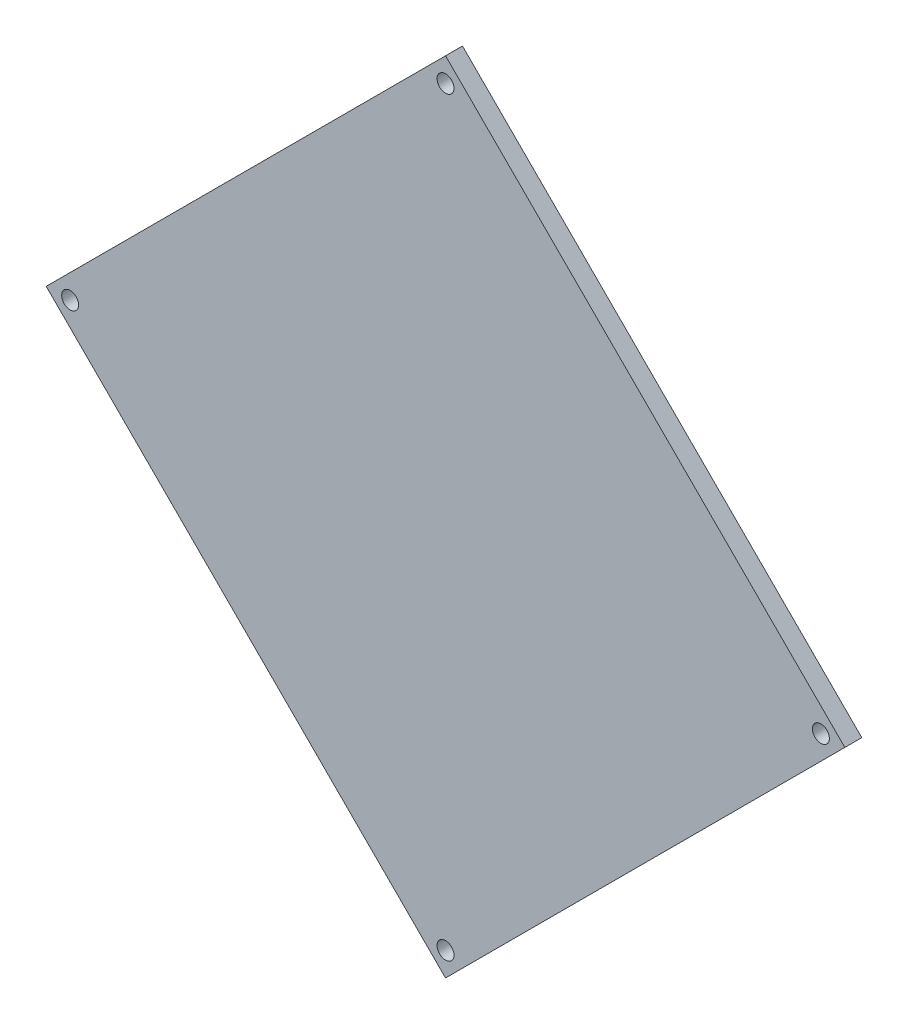
from build123d import *

# Parameters (mm, degrees)
SKETCH_1_R      = 1.5
EXTRUDE_1_DEPTH = 3


with BuildPart() as part:
    # 草图1 → 凸台-拉伸1 (new body)
    with BuildSketch(Plane.XY):
        Polygon((70.710678119, 0), (0, 70.710678119), (-70.710678119, 0), (0, -70.710678119), align=None)
        with Locations((0, 66.468037432)):
            Circle(SKETCH_1_R, mode=Mode.SUBTRACT)
        with Locations((66.468037432, 0)):
            Circle(SKETCH_1_R, mode=Mode.SUBTRACT)
        with Locations((0, -66.468037432)):
            Circle(SKETCH_1_R, mode=Mode.SUBTRACT)
        with Locations((-66.468037432, 0)):
            Circle(SKETCH_1_R, mode=Mode.SUBTRACT)
    extrude(amount=EXTRUDE_1_DEPTH)


solid = part.part
